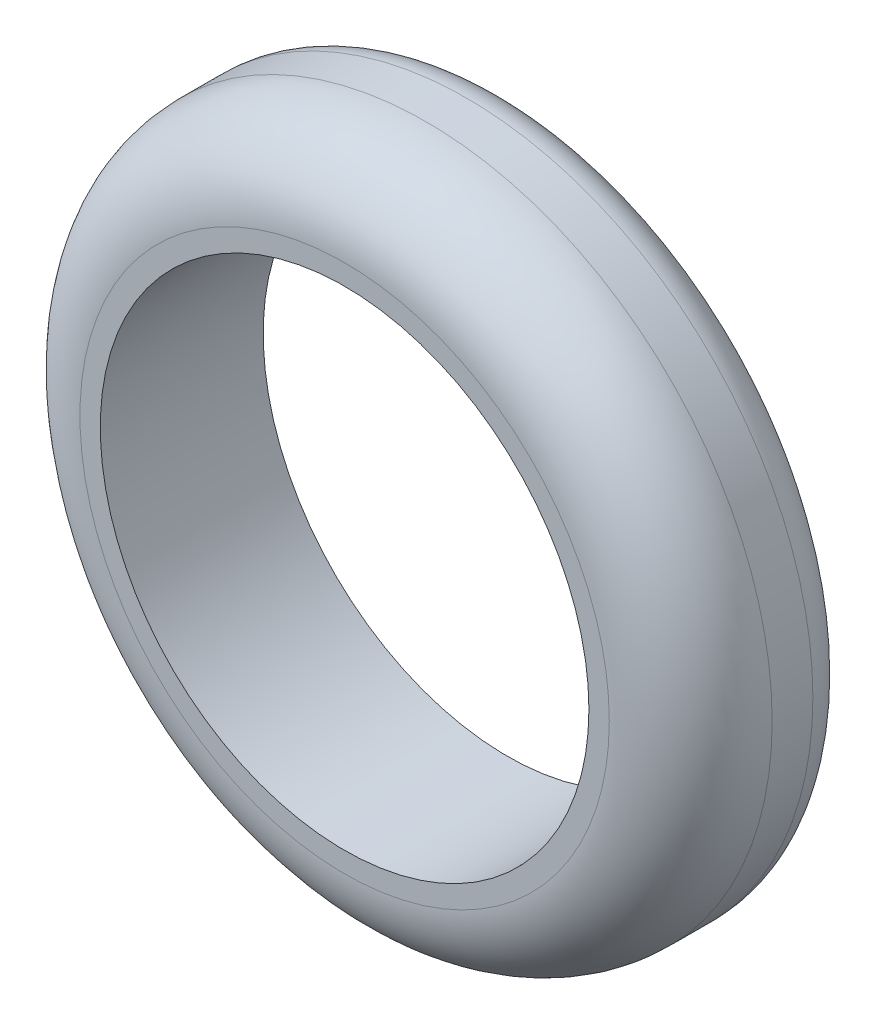
from build123d import *

# Parameters (mm, degrees)
SKETCH1_R           = 4.25
SKETCH1_R_2         = 3
BOSS_EXTRUDE2_DEPTH = 2
FILLET3_R           = 1
FILLET4_R           = 0.5


with BuildPart() as part:
    # Sketch1 → Boss-Extrude2 (new body)
    with BuildSketch(Plane.XY):
        Circle(SKETCH1_R)
        Circle(SKETCH1_R_2, mode=Mode.SUBTRACT)
    extrude(amount=BOSS_EXTRUDE2_DEPTH)

    # Fillet3
    fillet3_edges = [part.edges().sort_by_distance(p)[0] for p in [
        (-4.25, 0, 2),
    ]]
    fillet(fillet3_edges, radius=FILLET3_R)

    # Fillet4
    fillet4_edges = [part.edges().sort_by_distance(p)[0] for p in [
        (-4.25, 0, 0),
    ]]
    fillet(fillet4_edges, radius=FILLET4_R)


solid = part.part
